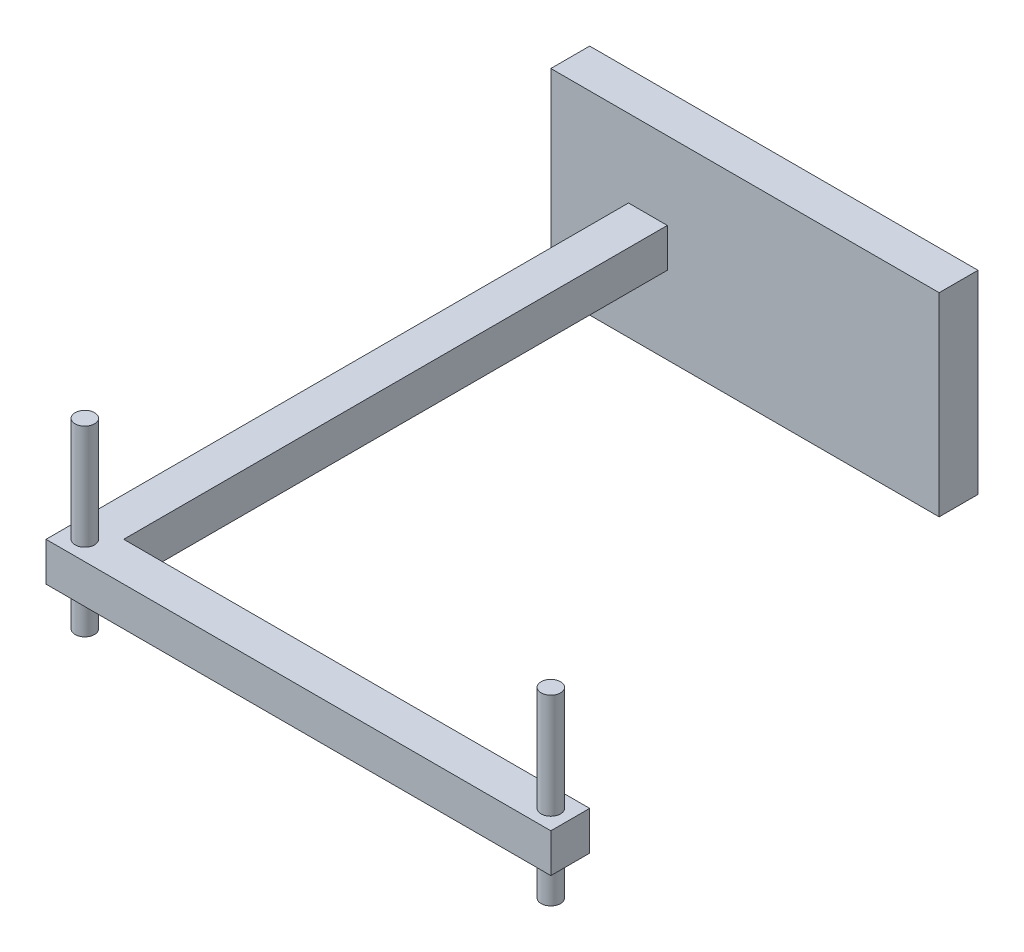
from build123d import *

# Parameters (mm, degrees)
SKETCH1_W           = 100
SKETCH1_H           = 50
BOSS_EXTRUDE1_DEPTH = 10
SKETCH2_W           = 10
SKETCH2_H           = 10
BOSS_EXTRUDE2_DEPTH = 150
SKETCH3_W           = 10
SKETCH3_H           = 10
BOSS_EXTRUDE3_DEPTH = 120
SKETCH4_R           = 2.5
BOSS_EXTRUDE4_DEPTH = 10
BOSS_EXTRUDE5_START = -27
SKETCH5_R           = 2.5
BOSS_EXTRUDE5_DEPTH = 27


with BuildPart() as part:
    # Sketch1 → Boss-Extrude1 (new body)
    with BuildSketch(Plane.XY):
        Rectangle(SKETCH1_W, SKETCH1_H)
    extrude(amount=BOSS_EXTRUDE1_DEPTH)

    # Sketch2 → Boss-Extrude2 (add)
    with BuildSketch(Plane.XY.offset(10)):
        with Locations((-25, 0)):
            Rectangle(SKETCH2_W, SKETCH2_H)
    extrude(amount=BOSS_EXTRUDE2_DEPTH)

    # Sketch3 → Boss-Extrude3 (add)
    with BuildSketch(Plane(origin=(-20, 0, 0), x_dir=(0, 0, -1), z_dir=(1, 0, 0))):
        with Locations((-155, 0)):
            Rectangle(SKETCH3_W, SKETCH3_H)
    extrude(amount=BOSS_EXTRUDE3_DEPTH)

    # Sketch4 → Boss-Extrude4 (add)
    with BuildSketch(Plane.XZ.offset(5)):
        with Locations(Location((-25, 155, 0), (0, 0, 180))):
            Circle(SKETCH4_R)
        with Locations(Location((95, 155, 0), (0, 0, 180))):
            Circle(SKETCH4_R)
    extrude(amount=BOSS_EXTRUDE4_DEPTH)

    # Sketch5 → Boss-Extrude5 (add)
    with BuildSketch(Plane(origin=(0, 5, -5), x_dir=(-1, 0, 0), z_dir=(0, -1, 0)).offset(BOSS_EXTRUDE5_START)):
        with Locations((-95, -160)):
            Circle(SKETCH5_R)
        with Locations((25, -160)):
            Circle(SKETCH5_R)
    extrude(amount=BOSS_EXTRUDE5_DEPTH)


solid = part.part
